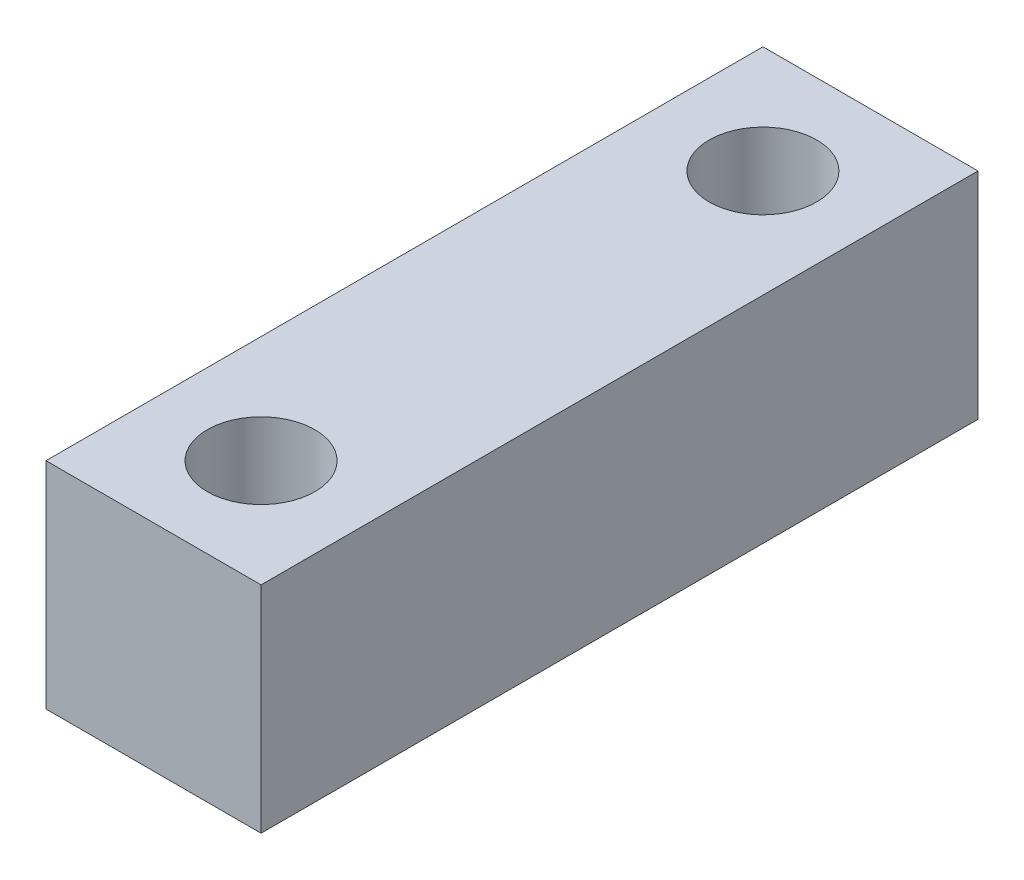
from build123d import *

# Parameters (mm, degrees)
SKETCH1_W           = 30
SKETCH1_H           = 30
BOSS_EXTRUDE1_DEPTH = 100
SKETCH2_R           = 7.5
CUT_EXTRUDE1_DEPTH  = 100


with BuildPart() as part:
    # Sketch1 → Boss-Extrude1 (new body)
    with BuildSketch(Plane.XY):
        Rectangle(SKETCH1_W, SKETCH1_H)
    extrude(amount=BOSS_EXTRUDE1_DEPTH)

    # Sketch2 → Cut-Extrude1 (cut)
    with BuildSketch(Plane(origin=(0, 15, 0), x_dir=(1, 0, 0), z_dir=(0, 1, 0))):
        with Locations(Location((0, -15, 0), (0, 0, 270))):
            Circle(SKETCH2_R)
        with Locations(Location((0, -85, 0), (0, 0, 270))):
            Circle(SKETCH2_R)
    extrude(amount=-CUT_EXTRUDE1_DEPTH, mode=Mode.SUBTRACT)


solid = part.part
